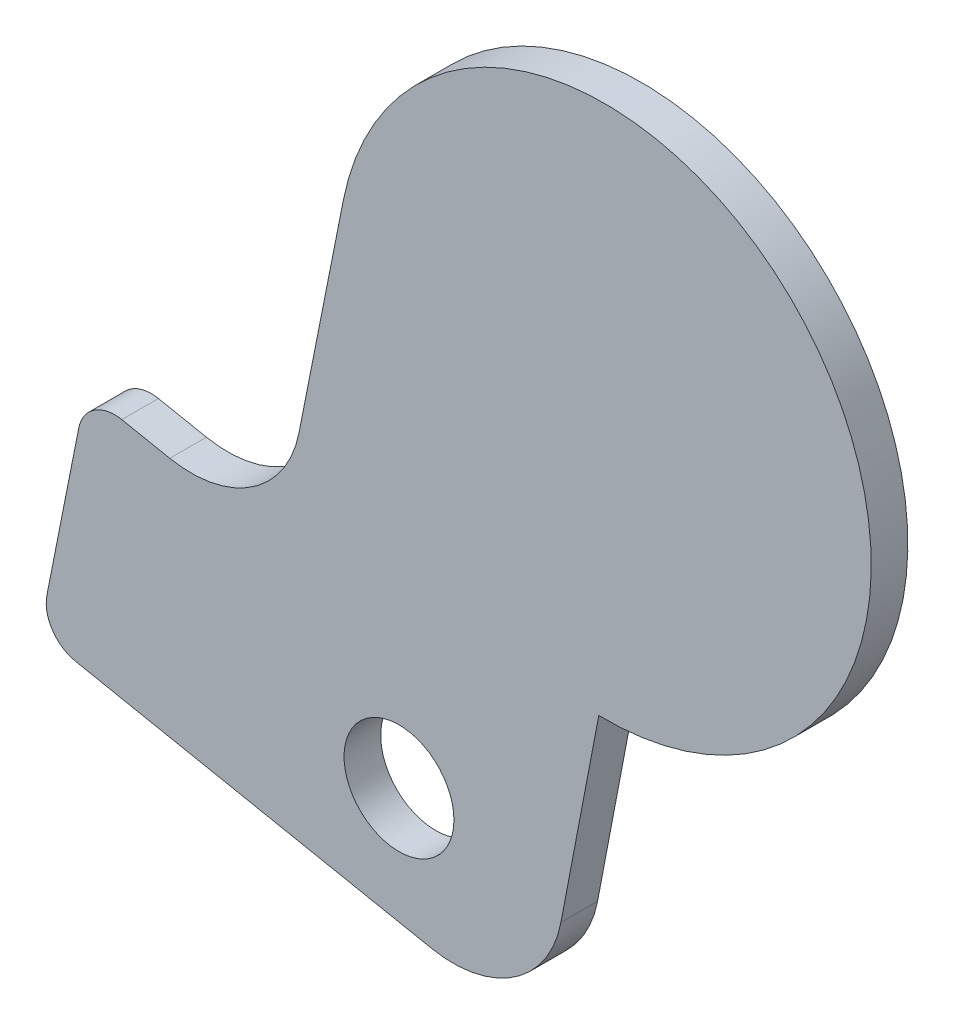
from build123d import *

# Parameters (mm, degrees)
SKETCH1_R           = 1.5
BOSS_EXTRUDE1_DEPTH = 1


with BuildPart() as part:
    # Sketch1 → Boss-Extrude1 (new body)
    with BuildSketch(Plane.XY):
        with BuildLine():
            Line((-13.546388506, 1.11267473), (-14.757525988, -4.995272772))
            ThreePointArc((-14.757525988, -4.995272772), (-16.032025568, -6.905175586), (-18.283738095, -7.354473522))
            Line((-18.283738095, -7.354473522), (-19.594124086, -7.094638677))
            ThreePointArc((-19.594124086, -7.094638677), (-20.344694929, -7.244404656), (-20.769528122, -7.881038927))
            Line((-20.769528122, -7.881038927), (-21.639356034, -12.267711208))
            ThreePointArc((-21.639356034, -12.267711208), (-21.489590055, -13.018282051), (-20.852955784, -13.443115244))
            Line((-20.852955784, -13.443115244), (-11.13347013, -15.370380234))
            ThreePointArc((-11.13347013, -15.370380234), (-8.873016287, -14.915211716), (-7.60323447, -12.990508078))
            Line((-7.60323447, -12.990508078), (-6.569563046, -7.578700869))
            ThreePointArc((-6.569563046, -7.578700869), (-0.732388238, 4.25291316), (-13.546388506, 1.11267473))
        make_face()
        with Locations((-12.024833612, -12.026666232)):
            Circle(SKETCH1_R, mode=Mode.SUBTRACT)
    extrude(amount=BOSS_EXTRUDE1_DEPTH)


solid = part.part
